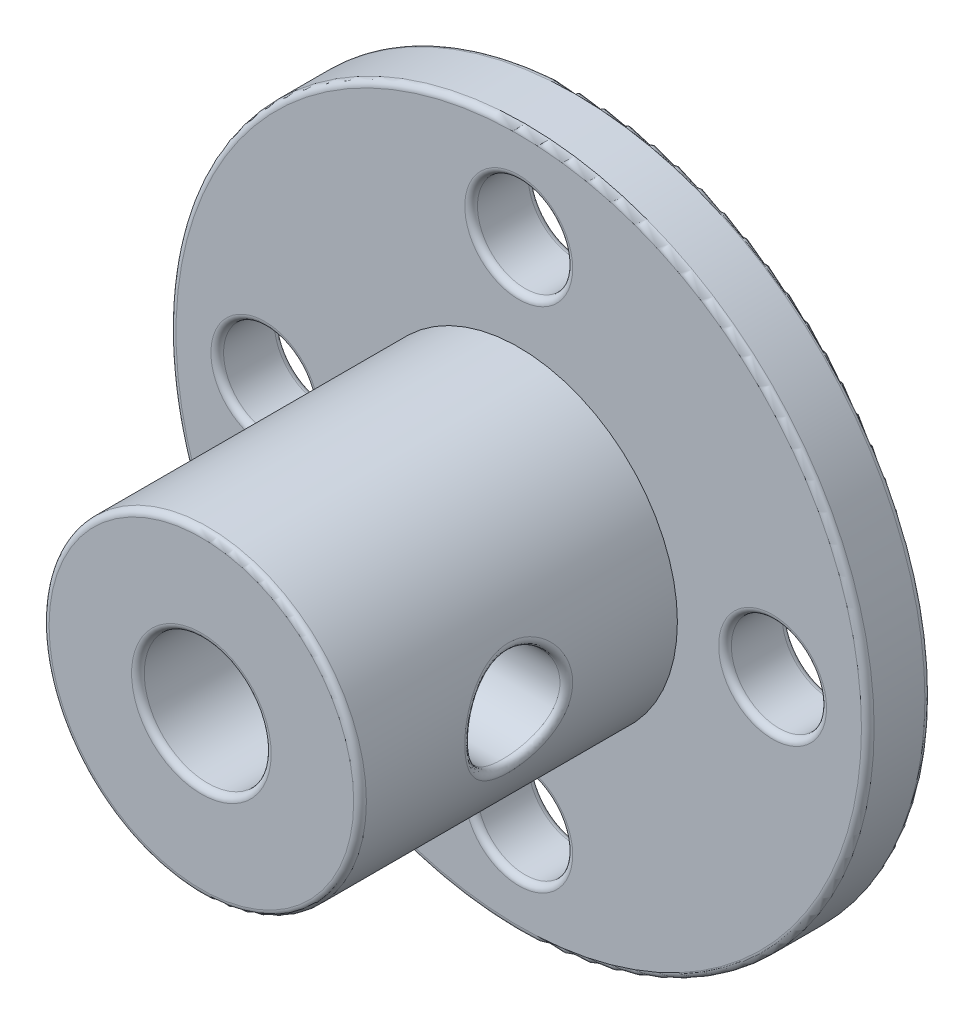
from build123d import *

# Parameters (mm, degrees)
SKETCH1_R               = 11
BOSS_EXTRUDE1_DEPTH     = 2
BOSS_EXTRUDE2_START     = 2
SKETCH2_R               = 5
BOSS_EXTRUDE2_DEPTH     = 10
SKETCH3_R               = 2
CUT_EXTRUDE1_DEPTH      = 20.646882704
SKETCH5_R               = 1.5
CUT_EXTRUDE2_DEPTH      = 20.646882704
CUT_EXTRUDE3_DEPTH      = 20.646882704
CUT_EXTRUDE3_DEPTH_BACK = 20.646882704
SKETCH6_R               = 1.5
FILLET1_R               = 0.2


with BuildPart() as part:
    # Sketch1 → Boss-Extrude1 (new body)
    with BuildSketch(Plane.XY):
        Circle(SKETCH1_R)
    extrude(amount=BOSS_EXTRUDE1_DEPTH)

    # Sketch2 → Boss-Extrude2 (add)
    with BuildSketch(Plane.XY.offset(BOSS_EXTRUDE2_START)):
        Circle(SKETCH2_R)
    extrude(amount=BOSS_EXTRUDE2_DEPTH)

    # Sketch3 → Cut-Extrude1 (cut, through all)
    with BuildSketch(Plane.XY):
        Circle(SKETCH3_R)
    extrude(amount=CUT_EXTRUDE1_DEPTH, mode=Mode.SUBTRACT)

    # Sketch5 → Cut-Extrude2 (cut, through all)
    with BuildSketch(Plane.XY):
        with Locations((0, 8)):
            Circle(SKETCH5_R)
        with Locations((8, 0)):
            Circle(SKETCH5_R)
        with Locations((0, -8)):
            Circle(SKETCH5_R)
        with Locations((-8, 0)):
            Circle(SKETCH5_R)
    extrude(amount=CUT_EXTRUDE2_DEPTH, mode=Mode.SUBTRACT)

    # Sketch6 → Cut-Extrude3 (cut, two sides: drawn at the far end of the back side and taken through both)
    with BuildSketch(Plane(origin=(0, 0, 0), x_dir=(0, 0, -1), z_dir=(1, 0, 0)).offset(-CUT_EXTRUDE3_DEPTH_BACK)):
        with Locations((-7, 0)):
            Circle(SKETCH6_R)
    extrude(amount=CUT_EXTRUDE3_DEPTH + CUT_EXTRUDE3_DEPTH_BACK, mode=Mode.SUBTRACT)

    # Fillet1
    fillet1_edges = [part.edges().sort_by_distance(p)[0] for p in [
        (-2, 0, 0),
        (-2, 0, 12),
        (-11, 0, 0),
        (-1.5, 8, 2),
        (-1.5, 8, 0),
        (6.5, 0, 2),
        (6.5, 0, 0),
        (-1.5, -8, 2),
        (-1.5, -8, 0),
        (-9.5, 0, 2),
        (-9.5, 0, 0),
        (-5, 0, 8.5),
        (4.769696007, 1.5, 7),
        (-11, 0, 2),
        (-5, 0, 12),
    ]]
    fillet(fillet1_edges, radius=FILLET1_R)


solid = part.part
